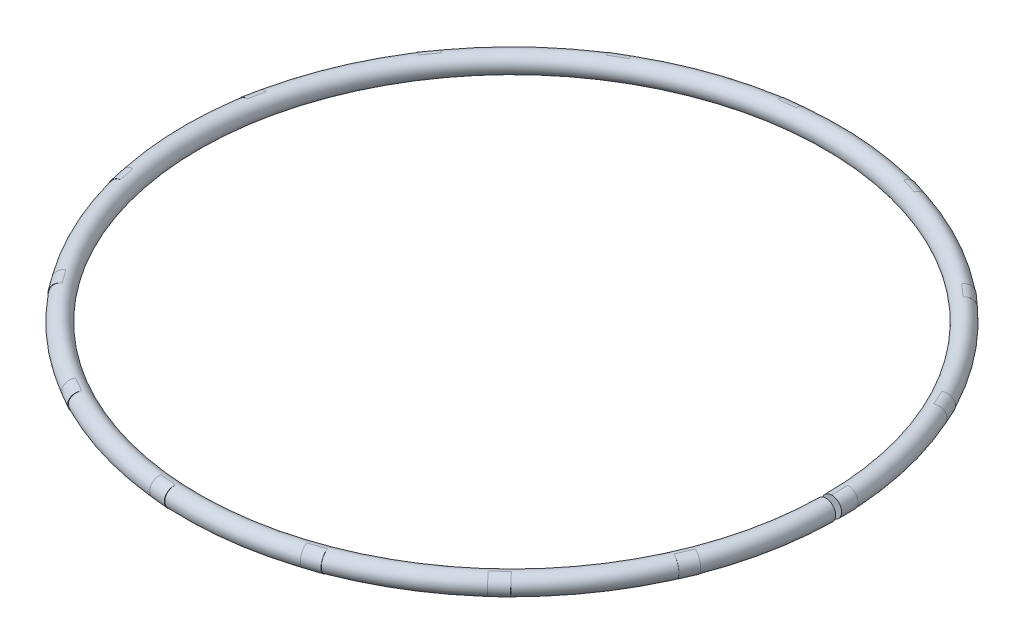
from build123d import *

# Parameters (mm, degrees)
ESBO_O1_R                = 0.6
REVOLU_O1_ANGLE          = 359
ESBO_O2_R                = 0.6
RESSALTO_EXTRUS_O1_DEPTH = 1
PADR_OCIRCULAR4_COUNT    = 15


with BuildPart() as part:
    # Esboço1 → Revolução1 (revolve)
    with BuildSketch(Plane.XY):
        with Locations((19.5, 0)):
            Circle(ESBO_O1_R)
    revolve(axis=Axis((0, 0, 0), (0, 1, 0)), revolution_arc=REVOLU_O1_ANGLE)


with BuildPart() as body_2:
    # Esboço2 → Ressalto-extrusão1 (new body)
    with BuildSketch(Plane.XY):
        with Locations((19.5, 0)):
            Circle(ESBO_O2_R)
    extrude(amount=-RESSALTO_EXTRUS_O1_DEPTH)


with BuildPart() as padr_ocircular4_1:
    # PadrãoCircular4: pattern copy
    add(body_2.part.rotate(Axis((0, 0, 0), (0, 1, 0)), 1 * 360 / PADR_OCIRCULAR4_COUNT))


with BuildPart() as padr_ocircular4_2:
    # PadrãoCircular4: pattern copy
    add(body_2.part.rotate(Axis((0, 0, 0), (0, 1, 0)), 2 * 360 / PADR_OCIRCULAR4_COUNT))


with BuildPart() as padr_ocircular4_3:
    # PadrãoCircular4: pattern copy
    add(body_2.part.rotate(Axis((0, 0, 0), (0, 1, 0)), 3 * 360 / PADR_OCIRCULAR4_COUNT))


with BuildPart() as padr_ocircular4_4:
    # PadrãoCircular4: pattern copy
    add(body_2.part.rotate(Axis((0, 0, 0), (0, 1, 0)), 4 * 360 / PADR_OCIRCULAR4_COUNT))


with BuildPart() as padr_ocircular4_5:
    # PadrãoCircular4: pattern copy
    add(body_2.part.rotate(Axis((0, 0, 0), (0, 1, 0)), 5 * 360 / PADR_OCIRCULAR4_COUNT))


with BuildPart() as padr_ocircular4_6:
    # PadrãoCircular4: pattern copy
    add(body_2.part.rotate(Axis((0, 0, 0), (0, 1, 0)), 6 * 360 / PADR_OCIRCULAR4_COUNT))


with BuildPart() as padr_ocircular4_7:
    # PadrãoCircular4: pattern copy
    add(body_2.part.rotate(Axis((0, 0, 0), (0, 1, 0)), 7 * 360 / PADR_OCIRCULAR4_COUNT))


with BuildPart() as padr_ocircular4_8:
    # PadrãoCircular4: pattern copy
    add(body_2.part.rotate(Axis((0, 0, 0), (0, 1, 0)), 8 * 360 / PADR_OCIRCULAR4_COUNT))


with BuildPart() as padr_ocircular4_9:
    # PadrãoCircular4: pattern copy
    add(body_2.part.rotate(Axis((0, 0, 0), (0, 1, 0)), 9 * 360 / PADR_OCIRCULAR4_COUNT))


with BuildPart() as padr_ocircular4_10:
    # PadrãoCircular4: pattern copy
    add(body_2.part.rotate(Axis((0, 0, 0), (0, 1, 0)), 10 * 360 / PADR_OCIRCULAR4_COUNT))


with BuildPart() as padr_ocircular4_11:
    # PadrãoCircular4: pattern copy
    add(body_2.part.rotate(Axis((0, 0, 0), (0, 1, 0)), 11 * 360 / PADR_OCIRCULAR4_COUNT))


with BuildPart() as padr_ocircular4_12:
    # PadrãoCircular4: pattern copy
    add(body_2.part.rotate(Axis((0, 0, 0), (0, 1, 0)), 12 * 360 / PADR_OCIRCULAR4_COUNT))


with BuildPart() as padr_ocircular4_13:
    # PadrãoCircular4: pattern copy
    add(body_2.part.rotate(Axis((0, 0, 0), (0, 1, 0)), 13 * 360 / PADR_OCIRCULAR4_COUNT))


with BuildPart() as padr_ocircular4_14:
    # PadrãoCircular4: pattern copy
    add(body_2.part.rotate(Axis((0, 0, 0), (0, 1, 0)), 14 * 360 / PADR_OCIRCULAR4_COUNT))


solid = Compound([part.part, body_2.part, padr_ocircular4_1.part, padr_ocircular4_2.part, padr_ocircular4_3.part, padr_ocircular4_4.part, padr_ocircular4_5.part, padr_ocircular4_6.part, padr_ocircular4_7.part, padr_ocircular4_8.part, padr_ocircular4_9.part, padr_ocircular4_10.part, padr_ocircular4_11.part, padr_ocircular4_12.part, padr_ocircular4_13.part, padr_ocircular4_14.part])
